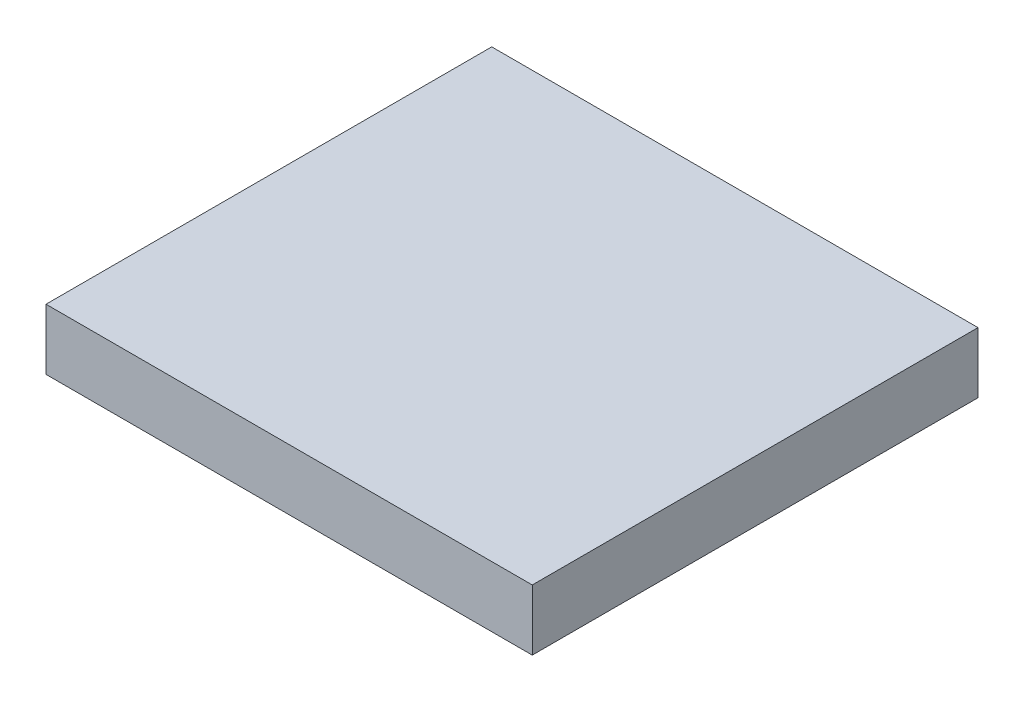
from build123d import *

# Parameters (mm, degrees)
BOSS_EXTRUDE1_START = -1100
SKETCH1_W           = 2400
SKETCH1_H           = 300
BOSS_EXTRUDE1_DEPTH = 2200


with BuildPart() as part:
    # Sketch1 → Boss-Extrude1 (new body)
    with BuildSketch(Plane.XY.offset(BOSS_EXTRUDE1_START)):
        with Locations((0, -80)):
            Rectangle(SKETCH1_W, SKETCH1_H)
    extrude(amount=BOSS_EXTRUDE1_DEPTH)


solid = part.part
